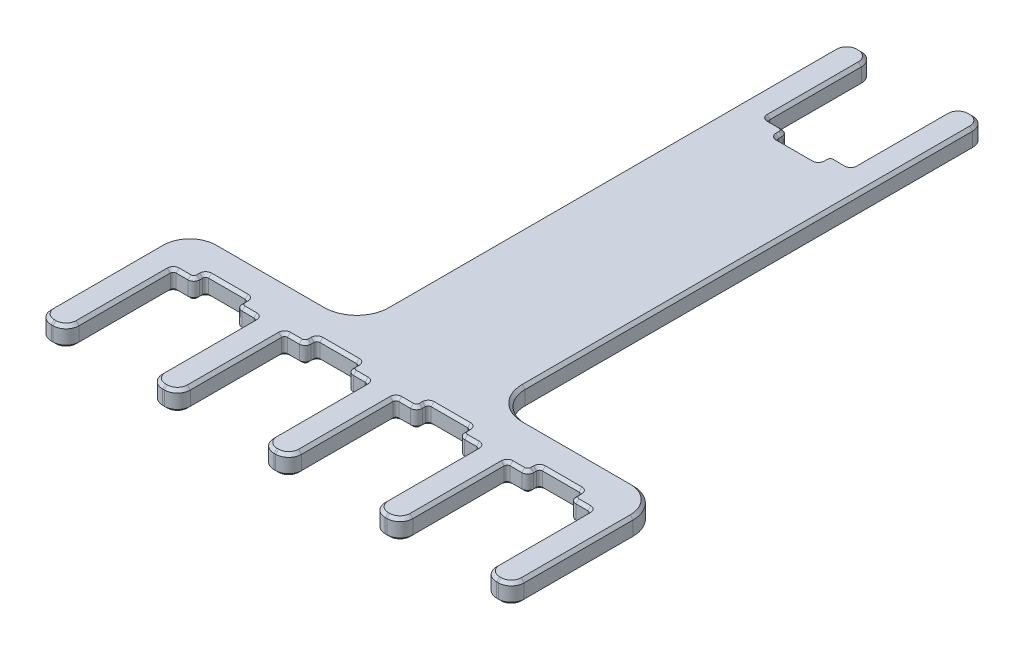
from build123d import *

# Parameters (mm, degrees)
BOSS_EXTRUDE1_DEPTH = 3.4
SKETCH3_W           = 7.2
SKETCH3_H           = 2
CUT_EXTRUDE1_DEPTH  = 3.4
FILLET1_R           = 5
FILLET2_R           = 2.2
FILLET3_R           = 0.5
FILLET4_R           = 1
CHAMFER1_SIZE       = 0.5


with BuildPart() as part:
    # Sketch1 → Boss-Extrude1 (new body)
    with BuildSketch(Plane(origin=(0, 0, 0), x_dir=(1, 0, 0), z_dir=(0, 1, 0))):
        Polygon((-28.991666667, 5.925), (-0.641666667, 5.925), (-0.641666667, 89.125), (4.058333333, 89.125), (4.058333333, 70.925), (18.258333333, 70.925), (18.258333333, 89.125), (22.958333333, 89.125), (22.958333333, 5.925), (51.308333333, 5.925), (51.308333333, -19.775), (-28.991666667, -19.775), align=None)
    extrude(amount=BOSS_EXTRUDE1_DEPTH)

    # Sketch3 → Cut-Extrude1 (cut)
    with BuildSketch(Plane(origin=(0, 3.4, 0), x_dir=(1, 0, 0), z_dir=(0, 1, 0))):
        Polygon((-24.291666667, -1.575), (-24.291666667, -19.775), (-10.091666667, -19.775), (-10.091666667, -1.575), (-13.591666667, -1.575), (-13.591666667, 0.425), (-20.791666667, 0.425), (-20.791666667, -1.575), align=None)
        Polygon((-5.391666667, -1.575), (-5.391666667, -19.775), (8.808333333, -19.775), (8.808333333, -1.575), (5.308333333, -1.575), (5.308333333, 0.425), (-1.891666667, 0.425), (-1.891666667, -1.575), align=None)
        Polygon((13.508333333, -1.575), (13.508333333, -19.775), (27.708333333, -19.775), (27.708333333, -1.575), (24.208333333, -1.575), (24.208333333, 0.425), (17.008333333, 0.425), (17.008333333, -1.575), align=None)
        Polygon((32.408333333, -1.575), (32.408333333, -19.775), (46.608333333, -19.775), (46.608333333, -1.575), (43.108333333, -1.575), (43.108333333, 0.425), (35.908333333, 0.425), (35.908333333, -1.575), align=None)
        with Locations((11.158333333, 69.925)):
            Rectangle(SKETCH3_W, SKETCH3_H)
    extrude(amount=-CUT_EXTRUDE1_DEPTH, mode=Mode.SUBTRACT)

    # Fillet1
    fillet1_edges = [part.edges().sort_by_distance(p)[0] for p in [
        (-28.991666667, 1.7, -5.925),
        (-0.641666667, 1.7, -5.925),
        (22.958333333, 1.7, -5.925),
        (51.308333333, 1.7, -5.925),
    ]]
    fillet(fillet1_edges, radius=FILLET1_R)

    # Fillet2
    fillet2_edges = [part.edges().sort_by_distance(p)[0] for p in [
        (27.708333333, 1.7, 19.775),
        (13.508333333, 1.7, 19.775),
        (8.808333333, 1.7, 19.775),
        (-5.391666667, 1.7, 19.775),
        (-0.641666667, 1.7, -89.125),
        (4.058333333, 1.7, -89.125),
        (18.258333333, 1.7, -89.125),
        (22.958333333, 1.7, -89.125),
        (51.308333333, 1.7, 19.775),
        (-28.991666667, 1.7, 19.775),
        (-10.091666667, 1.7, 19.775),
        (-24.291666667, 1.7, 19.775),
        (46.608333333, 1.7, 19.775),
        (32.408333333, 1.7, 19.775),
    ]]
    fillet(fillet2_edges, radius=FILLET2_R)

    # Fillet3
    fillet3_edges = [part.edges().sort_by_distance(p)[0] for p in [
        (13.508333333, 1.7, 1.575),
        (17.008333333, 1.7, -0.425),
        (24.208333333, 1.7, -0.425),
        (27.708333333, 1.7, 1.575),
        (-5.391666667, 1.7, 1.575),
        (-1.891666667, 1.7, -0.425),
        (5.308333333, 1.7, -0.425),
        (8.808333333, 1.7, 1.575),
        (4.058333333, 1.7, -70.925),
        (18.258333333, 1.7, -70.925),
        (-24.291666667, 1.7, 1.575),
        (-20.791666667, 1.7, -0.425),
        (-13.591666667, 1.7, -0.425),
        (-10.091666667, 1.7, 1.575),
        (14.758333333, 1.7, -68.925),
        (7.558333333, 1.7, -68.925),
        (32.408333333, 1.7, 1.575),
        (35.908333333, 1.7, -0.425),
        (43.108333333, 1.7, -0.425),
        (46.608333333, 1.7, 1.575),
    ]]
    fillet(fillet3_edges, radius=FILLET3_R)

    # Fillet4
    fillet4_edges = [part.edges().sort_by_distance(p)[0] for p in [
        (17.008333333, 1.7, 1.575),
        (24.208333333, 1.7, 1.575),
        (-1.891666667, 1.7, 1.575),
        (5.308333333, 1.7, 1.575),
        (-20.791666667, 1.7, 1.575),
        (-13.591666667, 1.7, 1.575),
        (7.558333333, 1.7, -70.925),
        (14.758333333, 1.7, -70.925),
        (35.908333333, 1.7, 1.575),
        (43.108333333, 1.7, 1.575),
    ]]
    fillet(fillet4_edges, radius=FILLET4_R)

    # Chamfer1
    chamfer1_edges = [part.edges().sort_by_distance(p)[0] for p in [
        (-28.991666667, 0, 8.325),
        (-28.991666667, 3.4, 8.325),
        (-14.816666667, 0, -5.925),
        (22.958333333, 0, -48.925),
        (37.133333333, 0, -5.925),
        (49.843867239, 0, -4.460533906),
        (-27.527200573, 0, -4.460533906),
        (-14.816666667, 3.4, -5.925),
        (37.133333333, 3.4, -5.925),
        (22.958333333, 3.4, -48.925),
        (49.843867239, 3.4, -4.460533906),
        (-27.527200573, 3.4, -4.460533906),
        (24.422799427, 0, -7.389466094),
        (24.422799427, 3.4, -7.389466094),
        (-2.106132761, 0, -7.389466094),
        (-2.106132761, 3.4, -7.389466094),
        (-0.641666667, 0, -48.925),
        (-0.641666667, 3.4, -48.925),
        (1.708333333, 0, -89.125),
        (18.258333333, 0, -79.175),
        (20.608333333, 0, -89.125),
        (51.308333333, 0, 8.325),
        (48.958333333, 0, 19.775),
        (46.608333333, 0, 9.825),
        (30.058333333, 0, 19.775),
        (27.708333333, 0, 9.825),
        (11.158333333, 0, 19.775),
        (8.808333333, 0, 9.825),
        (-7.741666667, 0, 19.775),
        (-10.091666667, 0, 9.825),
        (-26.641666667, 0, 19.775),
        (-28.347301585, 0, 19.130634919),
        (-24.936031748, 0, 19.130634919),
        (-9.447301585, 0, 19.130634919),
        (-6.036031748, 0, 19.130634919),
        (9.452698415, 0, 19.130634919),
        (12.863968252, 0, 19.130634919),
        (28.352698415, 0, 19.130634919),
        (31.763968252, 0, 19.130634919),
        (47.252698415, 0, 19.130634919),
        (50.663968252, 0, 19.130634919),
        (22.313968252, 0, -88.480634919),
        (18.902698415, 0, -88.480634919),
        (3.413968252, 0, -88.480634919),
        (0.002698415, 0, -88.480634919),
        (1.708333333, 3.4, -89.125),
        (-26.641666667, 3.4, 19.775),
        (-10.091666667, 3.4, 9.825),
        (-7.741666667, 3.4, 19.775),
        (8.808333333, 3.4, 9.825),
        (11.158333333, 3.4, 19.775),
        (27.708333333, 3.4, 9.825),
        (30.058333333, 3.4, 19.775),
        (46.608333333, 3.4, 9.825),
        (48.958333333, 3.4, 19.775),
        (51.308333333, 3.4, 8.325),
        (20.608333333, 3.4, -89.125),
        (18.258333333, 3.4, -79.175),
        (-28.347301585, 3.4, 19.130634919),
        (-24.936031748, 3.4, 19.130634919),
        (-9.447301585, 3.4, 19.130634919),
        (-6.036031748, 3.4, 19.130634919),
        (9.452698415, 3.4, 19.130634919),
        (12.863968252, 3.4, 19.130634919),
        (28.352698415, 3.4, 19.130634919),
        (31.763968252, 3.4, 19.130634919),
        (47.252698415, 3.4, 19.130634919),
        (50.663968252, 3.4, 19.130634919),
        (22.313968252, 3.4, -88.480634919),
        (18.902698415, 3.4, -88.480634919),
        (3.413968252, 3.4, -88.480634919),
        (0.002698415, 3.4, -88.480634919),
        (11.158333333, 3.4, -68.925),
        (11.158333333, 0, -68.925),
        (14.758333333, 3.4, -69.675),
        (14.758333333, 0, -69.675),
        (16.758333333, 0, -70.925),
        (16.758333333, 3.4, -70.925),
        (4.058333333, 0, -79.175),
        (4.058333333, 3.4, -79.175),
        (17.008333333, 3.4, 0.325),
        (17.008333333, 0, 0.325),
        (20.608333333, 3.4, -0.425),
        (20.608333333, 0, -0.425),
        (-1.891666667, 3.4, 0.325),
        (-1.891666667, 0, 0.325),
        (1.708333333, 3.4, -0.425),
        (1.708333333, 0, -0.425),
        (-20.791666667, 3.4, 0.325),
        (-20.791666667, 0, 0.325),
        (-17.191666667, 3.4, -0.425),
        (-17.191666667, 0, -0.425),
        (35.908333333, 3.4, 0.325),
        (35.908333333, 0, 0.325),
        (39.508333333, 3.4, -0.425),
        (39.508333333, 0, -0.425),
        (45.108333333, 3.4, 1.575),
        (45.108333333, 0, 1.575),
        (32.408333333, 3.4, 9.825),
        (32.408333333, 0, 9.825),
        (13.508333333, 3.4, 9.825),
        (13.508333333, 0, 9.825),
        (26.208333333, 3.4, 1.575),
        (26.208333333, 0, 1.575),
        (7.308333333, 3.4, 1.575),
        (7.308333333, 0, 1.575),
        (-5.391666667, 3.4, 9.825),
        (-5.391666667, 0, 9.825),
        (-11.591666667, 3.4, 1.575),
        (-11.591666667, 0, 1.575),
        (-24.291666667, 3.4, 9.825),
        (-24.291666667, 0, 9.825),
        (7.704779943, 3.4, -69.071446609),
        (7.704779943, 0, -69.071446609),
        (14.611886724, 3.4, -69.071446609),
        (14.611886724, 0, -69.071446609),
        (18.111886724, 0, -71.071446609),
        (18.111886724, 3.4, -71.071446609),
        (4.204779943, 0, -71.071446609),
        (4.204779943, 3.4, -71.071446609),
        (17.154779943, 3.4, -0.278553391),
        (17.154779943, 0, -0.278553391),
        (-1.745220057, 3.4, -0.278553391),
        (-1.745220057, 0, -0.278553391),
        (-20.645220057, 3.4, -0.278553391),
        (-20.645220057, 0, -0.278553391),
        (-13.738113276, 3.4, -0.278553391),
        (-13.738113276, 0, -0.278553391),
        (5.161886724, 3.4, -0.278553391),
        (5.161886724, 0, -0.278553391),
        (24.061886724, 3.4, -0.278553391),
        (24.061886724, 0, -0.278553391),
        (36.054779943, 3.4, -0.278553391),
        (36.054779943, 0, -0.278553391),
        (42.961886724, 3.4, -0.278553391),
        (42.961886724, 0, -0.278553391),
        (46.461886724, 3.4, 1.721446609),
        (46.461886724, 0, 1.721446609),
        (32.554779943, 3.4, 1.721446609),
        (32.554779943, 0, 1.721446609),
        (13.654779943, 3.4, 1.721446609),
        (13.654779943, 0, 1.721446609),
        (27.561886724, 3.4, 1.721446609),
        (27.561886724, 0, 1.721446609),
        (8.661886724, 3.4, 1.721446609),
        (8.661886724, 0, 1.721446609),
        (-5.245220057, 3.4, 1.721446609),
        (-5.245220057, 0, 1.721446609),
        (-10.238113276, 3.4, 1.721446609),
        (-10.238113276, 0, 1.721446609),
        (-24.145220057, 3.4, 1.721446609),
        (-24.145220057, 0, 1.721446609),
        (-13.591666667, 3.4, 0.325),
        (-13.591666667, 0, 0.325),
        (-22.791666667, 3.4, 1.575),
        (-3.891666667, 3.4, 1.575),
        (5.308333333, 3.4, 0.325),
        (15.008333333, 3.4, 1.575),
        (24.208333333, 3.4, 0.325),
        (33.908333333, 3.4, 1.575),
        (43.108333333, 3.4, 0.325),
        (7.558333333, 3.4, -69.675),
        (5.558333333, 3.4, -70.925),
        (7.265440115, 3.4, -70.632106781),
        (15.051226552, 3.4, -70.632106781),
        (-21.084559885, 3.4, 1.282106781),
        (43.401226552, 3.4, 1.282106781),
        (35.615440115, 3.4, 1.282106781),
        (24.501226552, 3.4, 1.282106781),
        (16.715440115, 3.4, 1.282106781),
        (5.601226552, 3.4, 1.282106781),
        (-2.184559885, 3.4, 1.282106781),
        (-13.298773448, 3.4, 1.282106781),
        (5.558333333, 0, -70.925),
        (7.558333333, 0, -69.675),
        (43.108333333, 0, 0.325),
        (33.908333333, 0, 1.575),
        (24.208333333, 0, 0.325),
        (15.008333333, 0, 1.575),
        (5.308333333, 0, 0.325),
        (-3.891666667, 0, 1.575),
        (-22.791666667, 0, 1.575),
        (7.265440115, 0, -70.632106781),
        (15.051226552, 0, -70.632106781),
        (-21.084559885, 0, 1.282106781),
        (43.401226552, 0, 1.282106781),
        (35.615440115, 0, 1.282106781),
        (24.501226552, 0, 1.282106781),
        (16.715440115, 0, 1.282106781),
        (5.601226552, 0, 1.282106781),
        (-2.184559885, 0, 1.282106781),
        (-13.298773448, 0, 1.282106781),
    ]]
    chamfer(chamfer1_edges, length=CHAMFER1_SIZE)


solid = part.part
